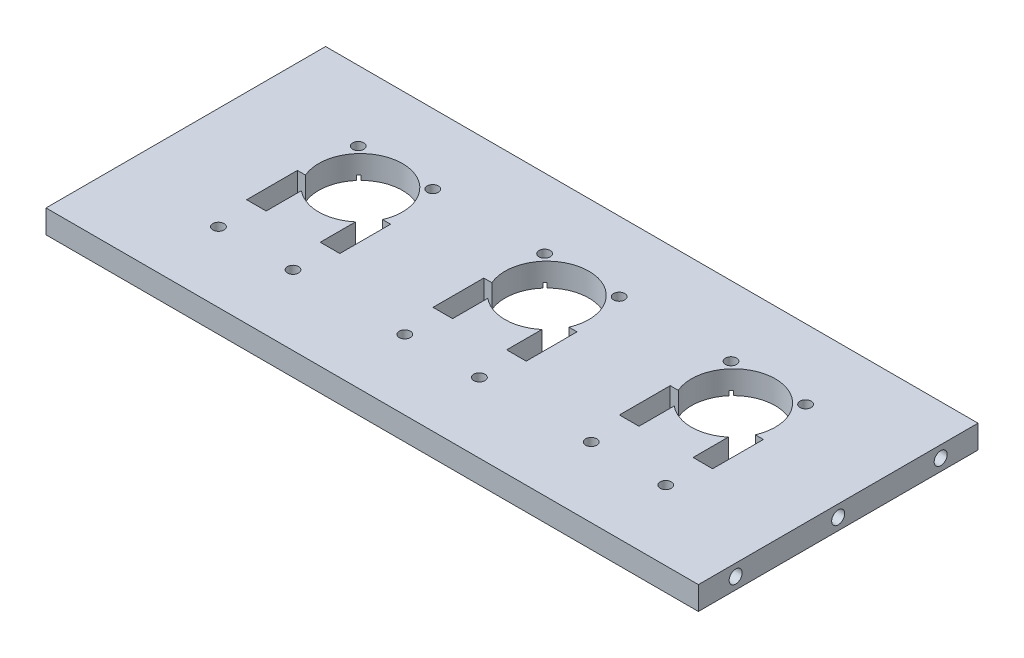
from build123d import *

# Parameters (mm, degrees)
SKETCH_1_W             = 140
SKETCH_1_H             = 60
EXTRUDE_1_DEPTH        = 5
SKETCH_2_R             = 1.2
CUT_EXTRUDE_1096_DEPTH = 153.397506541
SKETCH_4_R             = 1.4
CUT_EXTRUDE_3_DEPTH    = 5
PATTERN_LINEAR_1_COUNT = 3
PATTERN_LINEAR_1_PITCH = 40
SKETCH_6_R             = 2
CUT_EXTRUDE_4_DEPTH    = 1


with BuildPart() as part:
    # 草图1 → 凸台-拉伸1 (new body)
    with BuildSketch(Plane(origin=(0, 0, 0), x_dir=(1, 0, 0), z_dir=(0, 1, 0))):
        with Locations((70, -30)):
            Rectangle(SKETCH_1_W, SKETCH_1_H)
    extrude(amount=EXTRUDE_1_DEPTH)

    # 草图2 → Cut-Extrude 1096 (cut, through all)
    with BuildSketch(Plane(origin=(0, 5, 0), x_dir=(1, 0, 0), z_dir=(0, 1, 0))):
        with Locations((102, -15)):
            Circle(SKETCH_2_R)
        with Locations((118, -15)):
            Circle(SKETCH_2_R)
        with Locations((102, -45)):
            Circle(SKETCH_2_R)
        with Locations((118, -45)):
            Circle(SKETCH_2_R)
        with BuildLine():
            Line((100, -26.05), (100, -36.95))
            Line((100, -36.95), (104.2, -36.95))
            Line((104.2, -36.95), (104.2, -29.381860214))
            ThreePointArc((104.2, -29.381860214), (110, -31.5), (115.8, -29.381860214))
            Line((115.8, -29.381860214), (115.8, -36.95))
            Line((115.8, -36.95), (120, -36.95))
            Line((120, -36.95), (120, -26.05))
            Line((120, -26.05), (118.270278109, -26.05))
            ThreePointArc((118.270278109, -26.05), (110, -13.5), (101.729721891, -26.05))
            Line((101.729721891, -26.05), (100, -26.05))
        make_face()
    cut_extrude_1096 = extrude(amount=-CUT_EXTRUDE_1096_DEPTH, mode=Mode.SUBTRACT)

    # 草图4 → 切除-拉伸3 (cut)
    with BuildSketch(Plane.ZY):
        with Locations((30, 2.5)):
            Circle(SKETCH_4_R)
        with Locations((8, 2.5)):
            Circle(SKETCH_4_R)
        with Locations((52, 2.5)):
            Circle(SKETCH_4_R)
    cut_extrude_3 = extrude(amount=-CUT_EXTRUDE_3_DEPTH, mode=Mode.SUBTRACT)

    # 镜向1: 切除-拉伸3 across plane
    add(cut_extrude_3.mirror(Plane(origin=(70, 0, 0), x_dir=(0, 0, 1), z_dir=(1, 0, 0))), mode=Mode.SUBTRACT)

    # 阵列(线性)1: Cut-Extrude 1096 ×3
    with Locations(*[(-i * PATTERN_LINEAR_1_PITCH, 0, 0) for i in range(1, PATTERN_LINEAR_1_COUNT)]):
        add(cut_extrude_1096, mode=Mode.SUBTRACT)

    # 草图6 → 切除-拉伸4 (cut)
    with BuildSketch(Plane.XZ):
        with Locations((22, 45)):
            Circle(SKETCH_6_R)
        with Locations((38, 45)):
            Circle(SKETCH_6_R)
        with Locations((62, 45)):
            Circle(SKETCH_6_R)
        with Locations((78, 45)):
            Circle(SKETCH_6_R)
        with Locations((102, 45)):
            Circle(SKETCH_6_R)
        with Locations((118, 45)):
            Circle(SKETCH_6_R)
        with Locations((22, 15)):
            Circle(SKETCH_6_R)
        with Locations((38, 15)):
            Circle(SKETCH_6_R)
        with Locations((62, 15)):
            Circle(SKETCH_6_R)
        with Locations((78, 15)):
            Circle(SKETCH_6_R)
        with Locations((102, 15)):
            Circle(SKETCH_6_R)
        with Locations((118, 15)):
            Circle(SKETCH_6_R)
    extrude(amount=-CUT_EXTRUDE_4_DEPTH, mode=Mode.SUBTRACT)


solid = part.part
